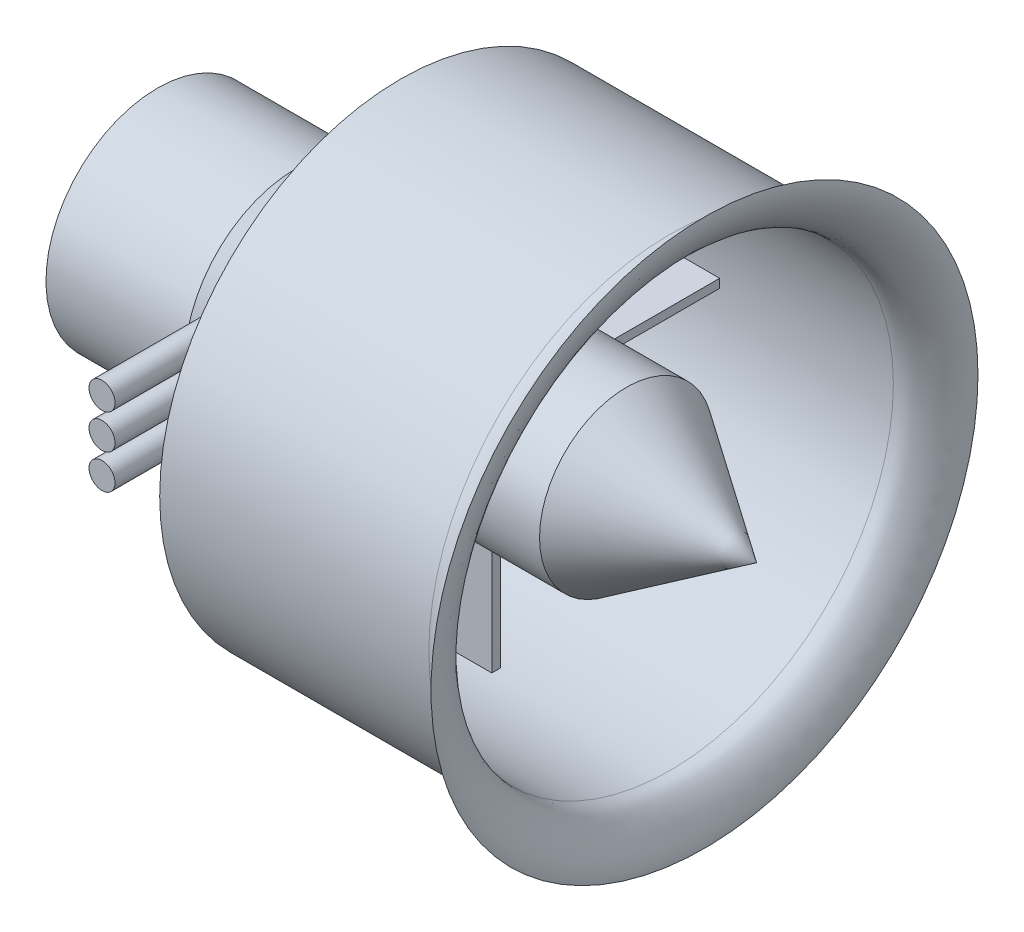
from build123d import *

# Parameters (mm, degrees)
BOSS_EXTRU_1_DEPTH           = 0.5
R_P_TITION_CIRCULAIRE1_COUNT = 8
ESQUISSE5_R                  = 1.5
BOSS_EXTRU_2_DEPTH           = 25


with BuildPart() as part:
    # Esquisse1 → Révolution1 (revolve)
    with BuildSketch(Plane.XY, mode=Mode.PRIVATE) as r_volution1_sk:
        with BuildLine():
            Line((-18.797047196, 27.75), (12.202952804, 27.75))
            ThreePointArc((12.202952804, 27.75), (14.944416829, 28.83410504), (16.202952804, 31.5))
            add(Edge.make_bspline(
                [(12.202952804, 25.75), (13.310921502, 25.75), (14.941747161, 27.131971286), (16.465207227, 29.749374737), (16.202952804, 31.5)],
                knots=[0, 0, 0, 0, 0.303786725, 1, 1, 1, 1], degree=3))
            Line((12.202952804, 25.75), (-18.797047196, 25.75))
            Line((-18.797047196, 25.75), (-18.797047196, 27.75))
        make_face()
    revolve(r_volution1_sk.sketch.rotate(Axis((0, 0, 0), (-1, 0, 0)), 90), axis=Axis((0, 0, 0), (-1, 0, 0)))

    # Esquisse3 → Boss.-Extru.1 (add, symmetric)
    with BuildSketch(Plane.XY):
        Polygon((-25.797047196, 10), (-18.797047196, 25.75), (-7.797047196, 25.75), (-7.797047196, 10), align=None)
    boss_extru_1 = extrude(amount=BOSS_EXTRU_1_DEPTH, both=True)

    # Répétition circulaire1: Boss.-Extru.1 ×8 about axis
    r_p_tition_circulaire1_axis = Axis((0, 0, 0), (1, 0, 0))
    for i in range(1, R_P_TITION_CIRCULAIRE1_COUNT):
        add(boss_extru_1.rotate(r_p_tition_circulaire1_axis, i * 360 / R_P_TITION_CIRCULAIRE1_COUNT))


with BuildPart() as body_2:
    # Esquisse2 → Révolution2 (revolve)
    with BuildSketch(Plane.XY, mode=Mode.PRIVATE) as r_volution2_sk:
        Polygon((22.202952804, 0), (7.202952804, 10), (-25.797047196, 10), (-25.797047196, 0), (7.202952804, 0), align=None)
    revolve(r_volution2_sk.sketch.rotate(Axis((7.202952804, 0, 0), (1, 0, 0)), 90), axis=Axis((7.202952804, 0, 0), (1, 0, 0)))


with BuildPart() as body_3:
    # Esquisse4 → Révolution3 (revolve)
    with BuildSketch(Plane.XY):
        Polygon((-54.297047196, 0), (-54.297047196, 1.5), (-52.097047196, 1.5), (-52.097047196, 4.5), (-50.097047196, 4.5), (-50.097047196, 6.362262945), (-46.797047196, 11.058827063), (-46.797047196, 12.85), (-30.797047196, 12.85), (-25.797047196, 10), (-25.797047196, 0), align=None)
    revolve(axis=Axis((0, 0, 0), (-1, 0, 0)))

    # Esquisse5 → Boss.-Extru.2 (add)
    with BuildSketch(Plane.XY):
        with Locations(Location((-28.189106073, 0, 0), (0, 0, 325.013813059))):
            Circle(ESQUISSE5_R)
        with Locations(Location((-28.189106073, -4, 0), (0, 0, 260.904193344))):
            Circle(ESQUISSE5_R)
        with Locations(Location((-28.189106073, 4, 0), (0, 0, 180))):
            Circle(ESQUISSE5_R)
    extrude(amount=BOSS_EXTRU_2_DEPTH)


solid = Compound([part.part, body_2.part, body_3.part])
